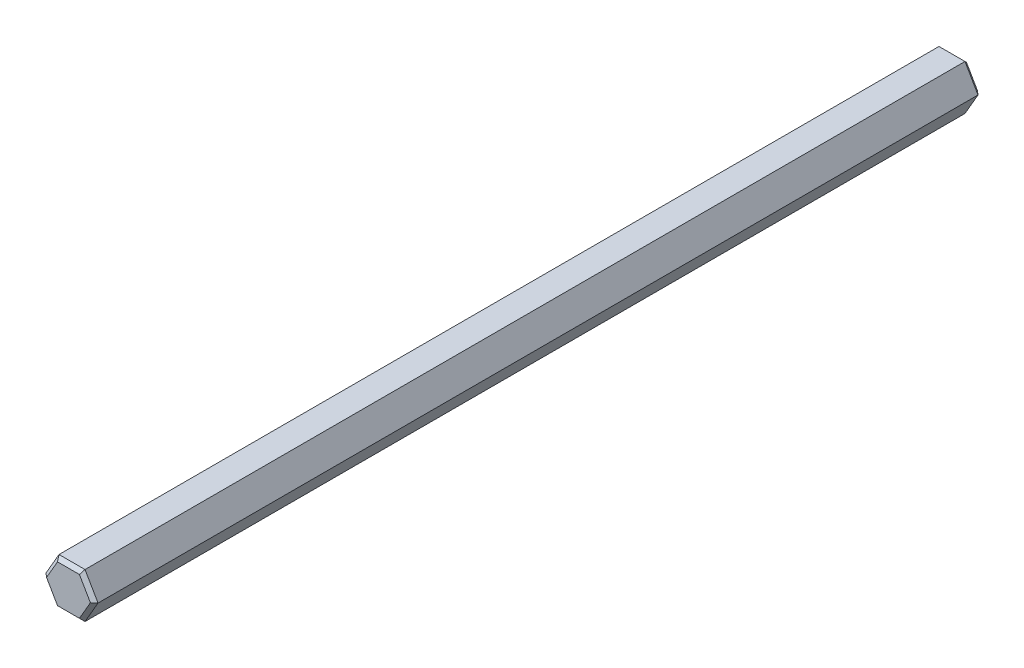
from build123d import *

# Parameters (mm, degrees)
BOSS_EXTRUDE1_DEPTH = 62.5
CHAMFER1_SIZE       = 0.5


with BuildPart() as part:
    # Sketch1 → Boss-Extrude1 (new, symmetric)
    with BuildSketch(Plane.XY):
        Polygon((3.666174209, 0), (1.833087105, 3.175), (-1.833087105, 3.175), (-3.666174209, 0), (-1.833087105, -3.175), (1.833087105, -3.175), align=None)
    extrude(amount=BOSS_EXTRUDE1_DEPTH, both=True)

    # Chamfer1
    chamfer1_edges = [part.edges().sort_by_distance(p)[0] for p in [
        (2.749630657, 1.5875, -62.5),
        (0, 3.175, -62.5),
        (-2.749630657, 1.5875, -62.5),
        (-2.749630657, -1.5875, -62.5),
        (0, -3.175, -62.5),
        (2.749630657, -1.5875, -62.5),
        (0, -3.175, 62.5),
        (-2.749630657, -1.5875, 62.5),
        (-2.749630657, 1.5875, 62.5),
        (0, 3.175, 62.5),
        (2.749630657, 1.5875, 62.5),
        (2.749630657, -1.5875, 62.5),
    ]]
    chamfer(chamfer1_edges, length=CHAMFER1_SIZE)


solid = part.part
